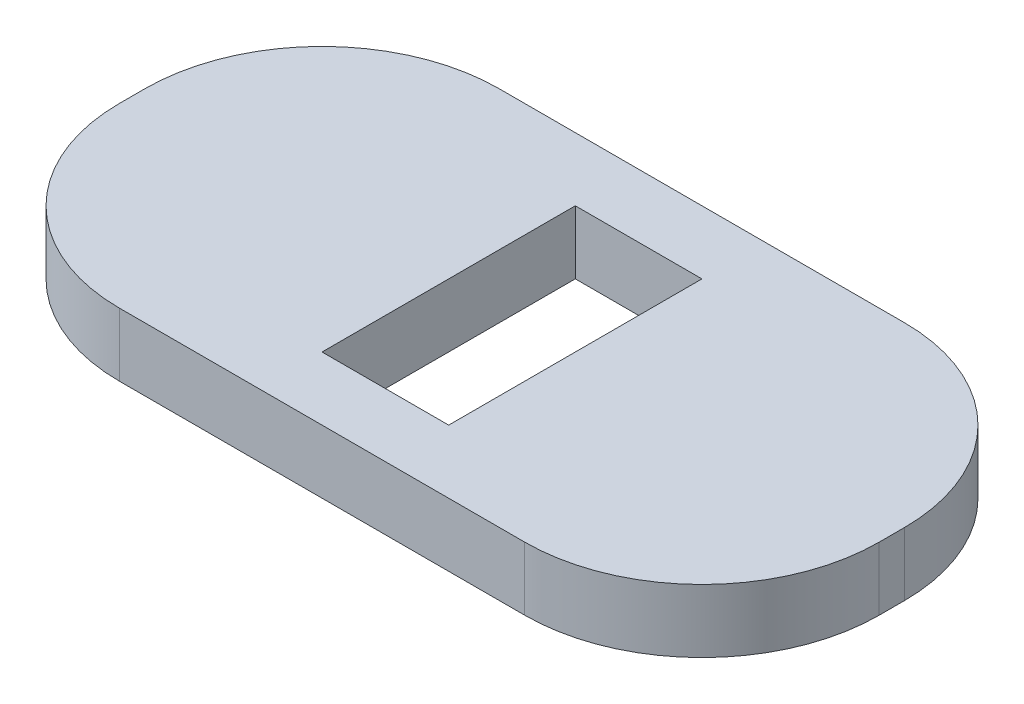
from build123d import *

# Parameters (mm, degrees)
SKETCH1_W           = 12.7
SKETCH1_H           = 25.4
BOSS_EXTRUDE1_DEPTH = 6.35


with BuildPart() as part:
    # Sketch1 → Boss-Extrude1 (new body)
    with BuildSketch(Plane(origin=(0, 0, 0), x_dir=(1, 0, 0), z_dir=(0, 1, 0))):
        with BuildLine():
            Line((17.78, 0), (58.42, 0))
            ThreePointArc((58.42, 0), (70.992358569, 5.207641431), (76.2, 17.78))
            Line((76.2, 17.78), (76.2, 20.32))
            ThreePointArc((76.2, 20.32), (70.992358569, 32.892358569), (58.42, 38.1))
            Line((58.42, 38.1), (17.78, 38.1))
            ThreePointArc((17.78, 38.1), (5.207641431, 32.892358569), (0, 20.32))
            Line((0, 20.32), (0, 17.78))
            ThreePointArc((0, 17.78), (5.207641431, 5.207641431), (17.78, 0))
        make_face()
        with Locations((38.1, 19.05)):
            Rectangle(SKETCH1_W, SKETCH1_H, mode=Mode.SUBTRACT)
    extrude(amount=BOSS_EXTRUDE1_DEPTH)


solid = part.part
